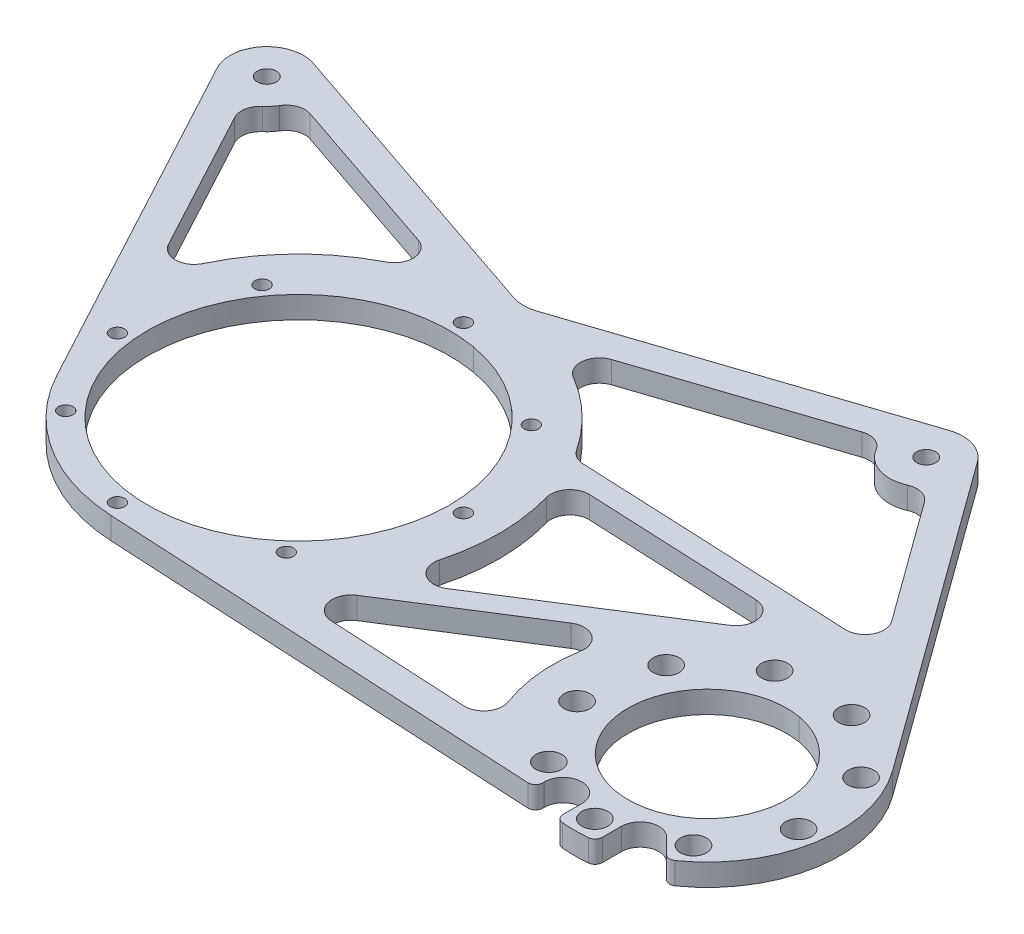
from build123d import *

# Parameters (mm, degrees)
SKETCH2_R           = 4.5
SKETCH2_R_2         = 27.4955
SKETCH2_R_3         = 2.5
SKETCH2_R_4         = 52.3875
SKETCH2_R_5         = 3.3
BOSS_EXTRUDE1_DEPTH = 7.62
CUT_EXTRUDE1_DEPTH  = 997.881811459
FILLET2_R           = 12.7
CUT_EXTRUDE2_DEPTH  = 997.881811459
FILLET3_R           = 6.604


with BuildPart() as part:
    # Sketch2 → Boss-Extrude1 (new body)
    with BuildSketch(Plane(origin=(0, 31.381947118, 0), x_dir=(1, 0, 0), z_dir=(0, 1, 0))):
        with BuildLine():
            ThreePointArc((-706.758334948, -176.701988839), (-700.258334948, -170.201988839), (-693.758334948, -176.701988839))
            Line((-693.758334948, -176.701988839), (-693.758334948, -183.274721629))
            ThreePointArc((-693.758334948, -183.274721629), (-693.101169654, -184.979577479), (-691.469725918, -185.802250576))
            ThreePointArc((-691.469725918, -185.802250576), (-686.919549358, -186.027976628), (-682.369372798, -185.802250576))
            ThreePointArc((-682.369372798, -185.802250576), (-680.737929062, -184.979577479), (-680.080763768, -183.274721629))
            Line((-680.080763768, -183.274721629), (-680.080763768, -176.701988839))
            ThreePointArc((-680.080763768, -176.701988839), (-676.068206079, -170.696771877), (-668.984569691, -172.105794761))
            Line((-668.984569691, -172.105794761), (-663.719686073, -177.370678379))
            ThreePointArc((-663.719686073, -177.370678379), (-662.142049476, -178.105218992), (-660.461885462, -177.651858179))
            ThreePointArc((-660.461885462, -177.651858179), (-641.567677603, -147.591642333), (-649.722430089, -113.035779166))
            Line((-649.722430089, -113.035779166), (-727.765593148, -5.590386169))
            ThreePointArc((-727.765593148, -5.590386169), (-732.27465506, -1.738553551), (-738.04104046, -0.353976628))
            Line((-738.04104046, -0.353976628), (-966.64104046, -0.353976628))
            ThreePointArc((-966.64104046, -0.353976628), (-977.541085398, -6.536383487), (-977.828766149, -19.064367123))
            Line((-977.828766149, -19.064367123), (-913.231203194, -139.306107665))
            ThreePointArc((-913.231203194, -139.306107665), (-891.842137326, -162.294673087), (-861.92593364, -171.83338557))
            Line((-861.92593364, -171.83338557), (-709.298334948, -179.818999281))
            ThreePointArc((-709.298334948, -179.818999281), (-707.502283723, -179.075050505), (-706.758334948, -177.278999281))
            Line((-706.758334948, -177.278999281), (-706.758334948, -176.701988839))
        make_face()
        with Locations((-686.919549358, -179.053976628)):
            Circle(SKETCH2_R, mode=Mode.SUBTRACT)
        with Locations((-711.988266136, -169.92970991)):
            Circle(SKETCH2_R, mode=Mode.SUBTRACT)
        with Locations((-661.85083258, -169.92970991)):
            Circle(SKETCH2_R, mode=Mode.SUBTRACT)
        with Locations((-725.327051725, -146.826255557)):
            Circle(SKETCH2_R, mode=Mode.SUBTRACT)
        with Locations((-686.919549358, -140.053976628)):
            Circle(SKETCH2_R_2, mode=Mode.SUBTRACT)
        with Locations((-648.51204699, -146.826255557)):
            Circle(SKETCH2_R, mode=Mode.SUBTRACT)
        with Locations((-720.694540106, -120.553976628)):
            Circle(SKETCH2_R, mode=Mode.SUBTRACT)
        with Locations((-653.14455861, -120.553976628)):
            Circle(SKETCH2_R, mode=Mode.SUBTRACT)
        with Locations((-700.258334948, -103.405964417)):
            Circle(SKETCH2_R, mode=Mode.SUBTRACT)
        with Locations((-673.580763768, -103.405964417)):
            Circle(SKETCH2_R, mode=Mode.SUBTRACT)
        with Locations((-858.69104046, -52.855453999)):
            Circle(SKETCH2_R_3, mode=Mode.SUBTRACT)
        with Locations((-816.220313684, -71.764639846)):
            Circle(SKETCH2_R_3, mode=Mode.SUBTRACT)
        with Locations((-901.161767236, -148.246268152)):
            Circle(SKETCH2_R_3, mode=Mode.SUBTRACT)
        with Locations((-864.664842136, -166.842380319)):
            Circle(SKETCH2_R_3, mode=Mode.SUBTRACT)
        with Locations((-820.450226307, -152.476180775)):
            Circle(SKETCH2_R_3, mode=Mode.SUBTRACT)
        with Locations((-915.52796678, -115.979255675)):
            Circle(SKETCH2_R_3, mode=Mode.SUBTRACT)
        with Locations((-858.69104046, -110.005453999)):
            Circle(SKETCH2_R_4, mode=Mode.SUBTRACT)
        with Locations((-801.54104046, -110.005453999)):
            Circle(SKETCH2_R_3, mode=Mode.SUBTRACT)
        with Locations((-904.926361688, -76.41352683)):
            Circle(SKETCH2_R_3, mode=Mode.SUBTRACT)
        with Locations((-966.64104046, -13.053976628)):
            Circle(SKETCH2_R_5, mode=Mode.SUBTRACT)
        with Locations((-738.04104046, -13.053976628)):
            Circle(SKETCH2_R_5, mode=Mode.SUBTRACT)
    extrude(amount=BOSS_EXTRUDE1_DEPTH)

    # Sketch3 → Cut-Extrude1 (cut, through all)
    with BuildSketch(Plane.XZ.offset(-31.381947118)):
        with BuildLine():
            Line((-966.64104046, 0.353976628), (-738.04104046, 0.353976628))
            ThreePointArc((-738.04104046, 0.353976628), (-740.069201275, 0.516968863), (-742.04530312, 1.001761871))
            Line((-742.04530312, 1.001761871), (-853.43712543, 38.010902819))
            Line((-853.43712543, 38.010902819), (-962.564577542, 1.025990509))
            ThreePointArc((-962.564577542, 1.025990509), (-964.575298912, 0.523106273), (-966.64104046, 0.353976628))
        make_face()
    extrude(amount=-CUT_EXTRUDE1_DEPTH, mode=Mode.SUBTRACT)

    # Fillet2
    fillet2_edges = [part.edges().sort_by_distance(p)[0] for p in [
        (-853.43712543, 35.191947118, 38.010902819),
    ]]
    fillet(fillet2_edges, radius=FILLET2_R)

    # Sketch4 → Cut-Extrude2 (cut, through all)
    with BuildSketch(Plane.XZ.offset(-31.381947118)):
        with BuildLine():
            Line((-926.258021859, 93.58986443), (-962.98962965, 25.217742455))
            ThreePointArc((-962.98962965, 25.217742455), (-956.946285575, 21.25773965), (-954.040776426, 14.642481046))
            Line((-954.040776426, 14.642481046), (-873.267054524, 42.017893591))
            ThreePointArc((-873.267054524, 42.017893591), (-907.186246099, 60.175908684), (-926.258021859, 93.58986443))
        make_face()
        with BuildLine():
            ThreePointArc((-750.650603562, 14.566893802), (-741.92637281, 25.145055675), (-728.673155688, 21.629099653))
            Line((-728.673155688, 21.629099653), (-686.683328555, 79.438308061))
            Line((-686.683328555, 79.438308061), (-798.984695976, 74.369503266))
            ThreePointArc((-798.984695976, 74.369503266), (-815.675199469, 55.375736994), (-838.053995618, 43.60604936))
            Line((-838.053995618, 43.60604936), (-750.650603562, 14.566893802))
        make_face()
        with BuildLine():
            ThreePointArc((-733.967803565, 114.387293709), (-740.490453219, 141.627220261), (-732.380486266, 168.437423414))
            Line((-732.380486266, 168.437423414), (-812.781759902, 164.230756215))
            Line((-812.781759902, 164.230756215), (-733.967803565, 114.387293709))
        make_face()
        with BuildLine():
            Line((-703.801263295, 86.293435405), (-799.833041569, 147.025779805))
            ThreePointArc((-799.833041569, 147.025779805), (-789.353275134, 115.205728597), (-794.969548727, 82.178487805))
            Line((-794.969548727, 82.178487805), (-703.801263295, 86.293435405))
        make_face()
    extrude(amount=-CUT_EXTRUDE2_DEPTH, mode=Mode.SUBTRACT)

    # Fillet3
    fillet3_edges = [part.edges().sort_by_distance(p)[0] for p in [
        (-733.967803565, 35.191947118, 114.387293709),
        (-732.380486266, 35.191947118, 168.437423414),
        (-812.781759902, 35.191947118, 164.230756215),
        (-703.801263295, 35.191947118, 86.293435405),
        (-794.969548727, 35.191947118, 82.178487805),
        (-799.833041569, 35.191947118, 147.025779805),
        (-686.683328555, 35.191947118, 79.438308061),
        (-798.984695976, 35.191947118, 74.369503266),
        (-838.053995618, 35.191947118, 43.60604936),
        (-750.650603562, 35.191947118, 14.566893802),
        (-728.673155688, 35.191947118, 21.629099653),
        (-954.040776426, 35.191947118, 14.642481046),
        (-962.98962965, 35.191947118, 25.217742455),
        (-873.267054524, 35.191947118, 42.017893591),
        (-926.258021859, 35.191947118, 93.58986443),
    ]]
    fillet(fillet3_edges, radius=FILLET3_R)


solid = part.part
